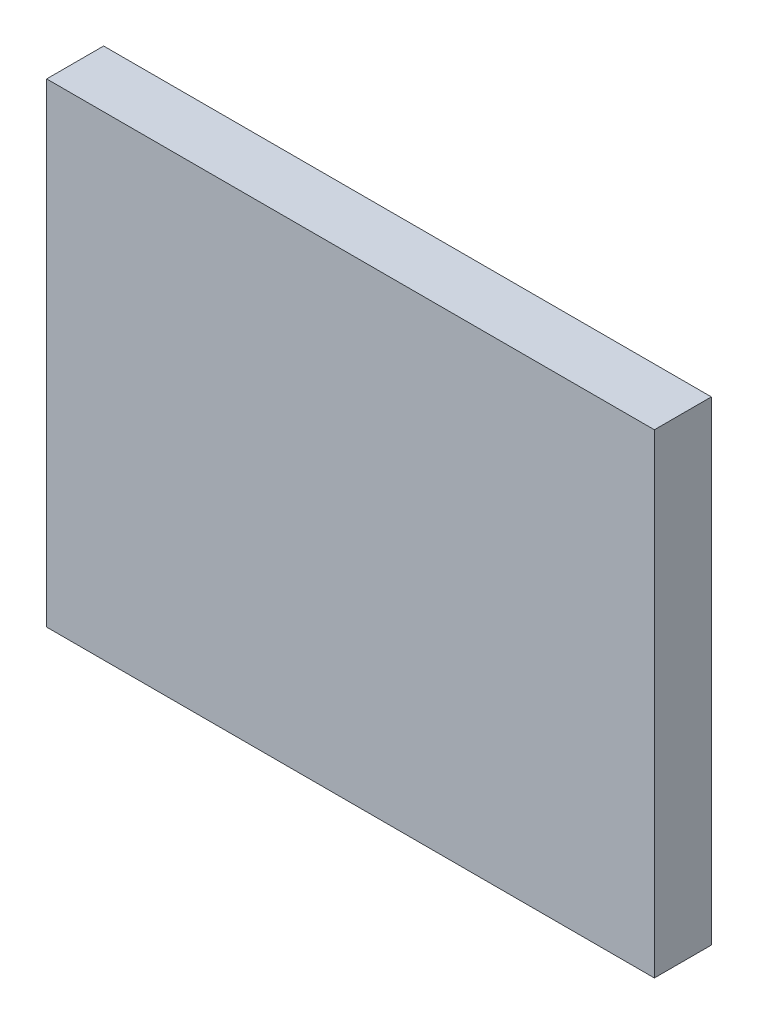
from build123d import *

# Parameters (mm, degrees)
SKETCH1_W           = 203.2
SKETCH1_H           = 158.75
BOSS_EXTRUDE1_DEPTH = 19.05


with BuildPart() as part:
    # Sketch1 → Boss-Extrude1 (new body)
    with BuildSketch(Plane.XY):
        with Locations((0, -79.375)):
            Rectangle(SKETCH1_W, SKETCH1_H)
    extrude(amount=BOSS_EXTRUDE1_DEPTH)


solid = part.part
